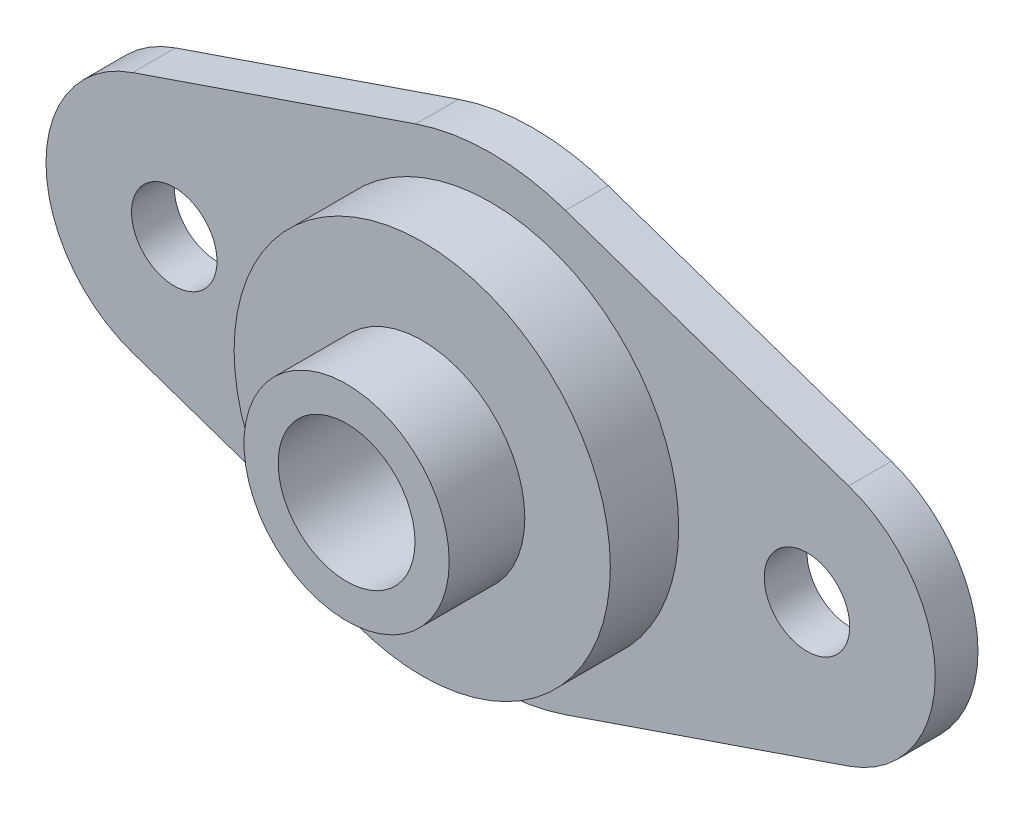
from build123d import *

# Parameters (mm, degrees)
SKETCH2_R           = 4
SKETCH2_R_2         = 2.5
BOSS_EXTRUDE1_DEPTH = 2.5
SKETCH3_R           = 6
SKETCH3_R_2         = 4
BOSS_EXTRUDE2_DEPTH = 10.922
SKETCH4_R           = 11
SKETCH4_R_2         = 6
BOSS_EXTRUDE3_DEPTH = 4


with BuildPart() as part:
    # Sketch2 → Boss-Extrude1 (new body)
    with BuildSketch(Plane.XY):
        with BuildLine():
            ThreePointArc((20.932432432, -7.094594595), (26, 0), (20.932432432, 7.094594595))
            Line((20.932432432, 7.094594595), (4.378378378, 12.77027027))
            ThreePointArc((4.378378378, 12.77027027), (0, 13.5), (-4.378378378, 12.77027027))
            Line((-4.378378378, 12.77027027), (-20.932432432, 7.094594595))
            ThreePointArc((-20.932432432, 7.094594595), (-26, 0), (-20.932432432, -7.094594595))
            Line((-20.932432432, -7.094594595), (-4.378378378, -12.77027027))
            ThreePointArc((-4.378378378, -12.77027027), (0, -13.5), (4.378378378, -12.77027027))
            Line((4.378378378, -12.77027027), (20.932432432, -7.094594595))
        make_face()
        Circle(SKETCH2_R, mode=Mode.SUBTRACT)
        with Locations((18.5, 0)):
            Circle(SKETCH2_R_2, mode=Mode.SUBTRACT)
        with Locations((-18.5, 0)):
            Circle(SKETCH2_R_2, mode=Mode.SUBTRACT)
    extrude(amount=BOSS_EXTRUDE1_DEPTH)

    # Sketch3 → Boss-Extrude2 (add)
    with BuildSketch(Plane.XY):
        Circle(SKETCH3_R)
        Circle(SKETCH3_R_2, mode=Mode.SUBTRACT)
    extrude(amount=BOSS_EXTRUDE2_DEPTH)

    # Sketch4 → Boss-Extrude3 (add)
    with BuildSketch(Plane.XY.offset(2.5)):
        Circle(SKETCH4_R)
        Circle(SKETCH4_R_2, mode=Mode.SUBTRACT)
    extrude(amount=BOSS_EXTRUDE3_DEPTH)


solid = part.part
